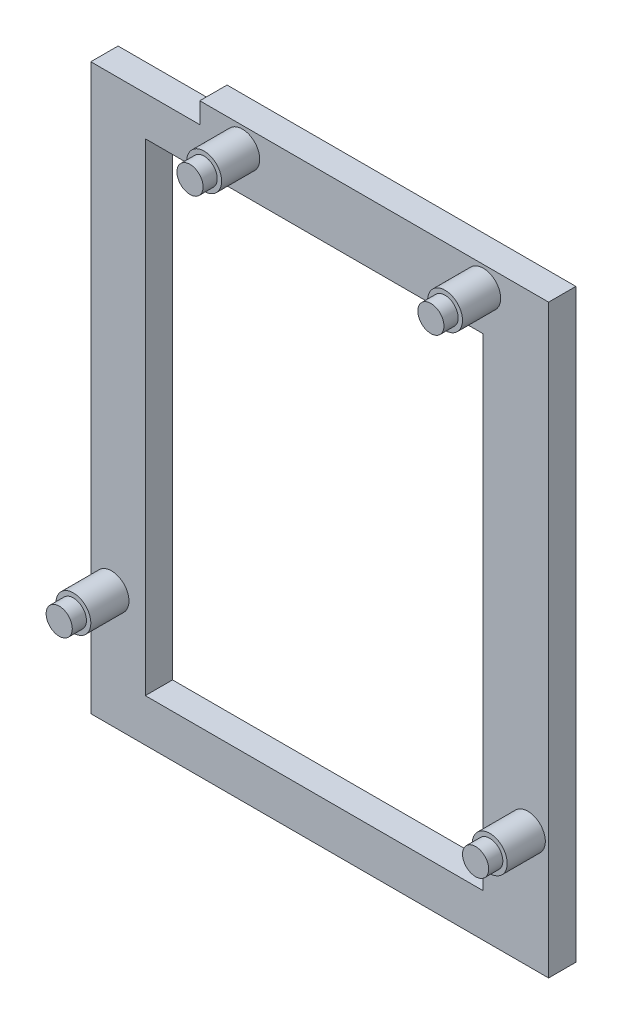
from build123d import *

# Parameters (mm, degrees)
SKETCH1_R           = 2.032
SKETCH1_W           = 33.02
SKETCH1_H           = 52.3843179
BOSS_EXTRUDE1_DEPTH = 3.175
SKETCH1_3_R         = 2.032
SKETCH1_3_R_2       = 1.524
BOSS_EXTRUDE2_DEPTH = 7.62
SKETCH1_4_R         = 1.524
BOSS_EXTRUDE3_DEPTH = 9.271
SKETCH2_W           = 6.35
SKETCH2_H           = 52.3843179
CUT_EXTRUDE1_DEPTH  = 9.271


with BuildPart() as part:
    # Sketch1 → Boss-Extrude1 (new body)
    with BuildSketch(Plane.XY):
        Polygon((53.34, 68.199), (53.34, 65.786), (53.34, 0), (0, 0), (0, 65.786), (12.7, 65.786), (12.7, 68.199), (45.72, 68.199), align=None)
        with Locations((45.72, 65.786)):
            Circle(SKETCH1_R, mode=Mode.SUBTRACT)
        with Locations((17.653, 65.786)):
            Circle(SKETCH1_R, mode=Mode.SUBTRACT)
        with Locations((2.413, 13.589)):
            Circle(SKETCH1_R, mode=Mode.SUBTRACT)
        with Locations((50.927, 13.589)):
            Circle(SKETCH1_R, mode=Mode.SUBTRACT)
        with Locations((29.21, 31.18869335)):
            Rectangle(SKETCH1_W, SKETCH1_H, mode=Mode.SUBTRACT)
    extrude(amount=BOSS_EXTRUDE1_DEPTH)

    # Sketch1<3> → Boss-Extrude2 (add)
    # profile 1 of 4: a face of its own
    with BuildSketch(Plane.XY):
        with Locations(Location((17.653, 65.786, 0), (0, 0, 180))):
            Circle(SKETCH1_3_R)
        with Locations(Location((17.653, 65.786, 0), (0, 0, 180))):
            Circle(SKETCH1_3_R_2, mode=Mode.SUBTRACT)
    # profile 2 of 4: a face of its own
    with BuildSketch(Plane.XY):
        with Locations(Location((45.72, 65.786, 0), (0, 0, 180))):
            Circle(SKETCH1_3_R)
        with Locations(Location((45.72, 65.786, 0), (0, 0, 180))):
            Circle(SKETCH1_3_R_2, mode=Mode.SUBTRACT)
    # profile 3 of 4: a face of its own
    with BuildSketch(Plane.XY):
        with Locations(Location((50.927, 13.589, 0), (0, 0, 180))):
            Circle(SKETCH1_3_R)
        with Locations(Location((50.927, 13.589, 0), (0, 0, 180))):
            Circle(SKETCH1_3_R_2, mode=Mode.SUBTRACT)
    # profile 4 of 4: a face of its own
    with BuildSketch(Plane.XY):
        with Locations(Location((2.413, 13.589, 0), (0, 0, 180))):
            Circle(SKETCH1_3_R)
        with Locations(Location((2.413, 13.589, 0), (0, 0, 180))):
            Circle(SKETCH1_3_R_2, mode=Mode.SUBTRACT)
    extrude(amount=BOSS_EXTRUDE2_DEPTH)

    # Sketch1<4> → Boss-Extrude3 (add)
    with BuildSketch(Plane.XY):
        with Locations((2.413, 13.589)):
            Circle(SKETCH1_4_R)
        with Locations((17.653, 65.786)):
            Circle(SKETCH1_4_R)
        with Locations((45.72, 65.786)):
            Circle(SKETCH1_4_R)
        with Locations((50.927, 13.589)):
            Circle(SKETCH1_4_R)
    extrude(amount=BOSS_EXTRUDE3_DEPTH)

    # Sketch2 → Cut-Extrude1 (cut)
    with BuildSketch(Plane.XY.offset(3.175)):
        with Locations((9.525, 31.18869335)):
            Rectangle(SKETCH2_W, SKETCH2_H)
        Polygon((45.72, 57.3808523), (45.72, 61.1908523), (6.35, 61.1908523), (6.35, 57.3808523), (12.7, 57.3808523), align=None)
    extrude(amount=-CUT_EXTRUDE1_DEPTH, mode=Mode.SUBTRACT)


solid = part.part
